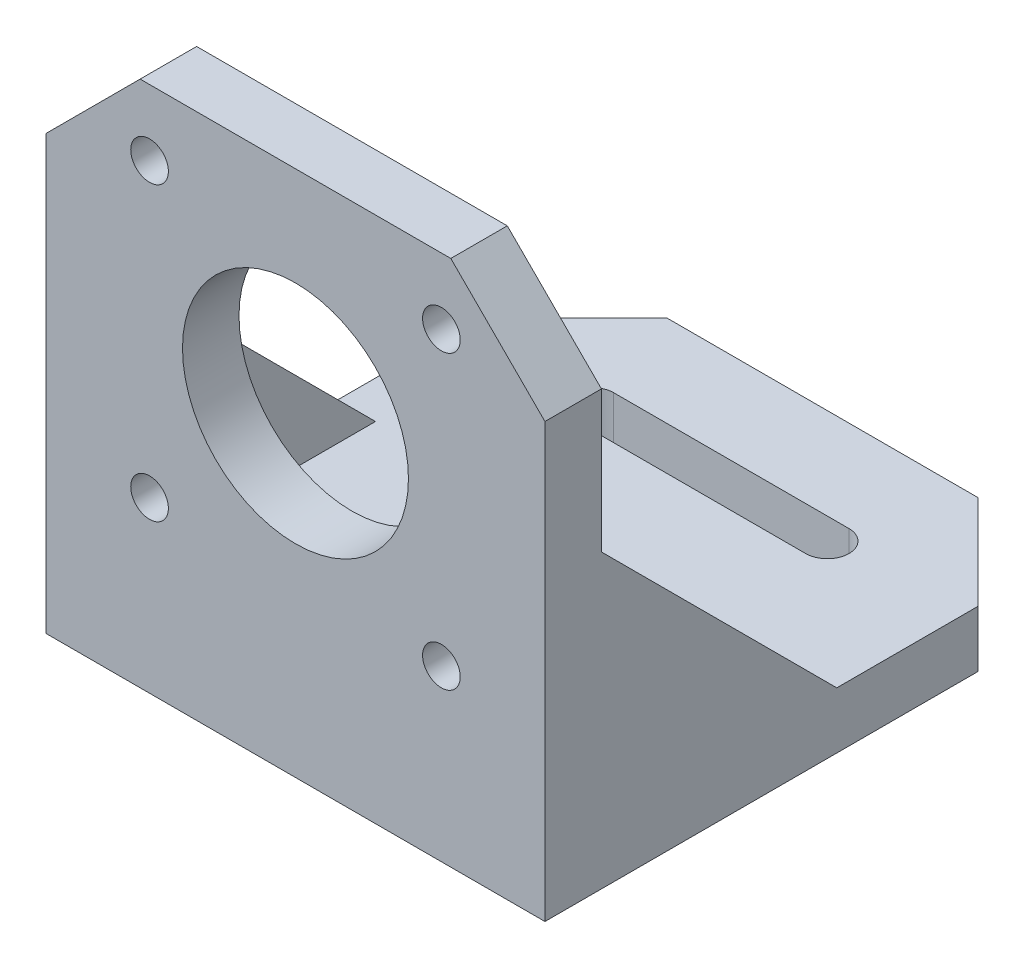
from build123d import *

# Parameters (mm, degrees)
EXTRUDE_1_DEPTH          = 53
EXTRUDE_2_DEPTH          = 4
EXTRUDE_3_DEPTH          = 4
CUT_EXTRUDE_1_DEPTH      = 96.294281046
CUT_EXTRUDE_1_DEPTH_BACK = 96.294281046
SKETCH_4_R               = 2
SKETCH_4_R_2             = 12
CHAMFER_1_SIZE           = 10
CUT_EXTRUDE_2_DEPTH      = 92.896681115
CHAMFER_2_SIZE           = 10
FILLET_1_R               = 3


with BuildPart() as part:
    # Эскиз1 → Бобышка-Вытянуть1 (new body)
    with BuildSketch(Plane(origin=(0, 0, 0), x_dir=(0, 0, -1), z_dir=(1, 0, 0))):
        Polygon((0, 0), (0, 56), (6, 56), (6, 6), (56, 6), (56, 0), align=None)
    extrude(amount=EXTRUDE_1_DEPTH)

    # Эскиз2 → Бобышка-Вытянуть2 (add)
    with BuildSketch(Plane(origin=(53, 0, 0), x_dir=(0, 0, -1), z_dir=(1, 0, 0))):
        Polygon((6, 31), (31, 6), (6, 6), align=None)
    extrude(amount=-EXTRUDE_2_DEPTH)

    # Эскиз4 → Вырез-Вытянуть1 (cut, two sides: drawn at the far end of the back side and taken through both)
    with BuildSketch(Plane.XY.offset(-CUT_EXTRUDE_1_DEPTH_BACK)):
        with Locations(Location((11, 49, 0), (0, 0, 270))):
            Circle(SKETCH_4_R)
        with Locations(Location((42, 49, 0), (0, 0, 270))):
            Circle(SKETCH_4_R)
        with Locations(Location((42, 18, 0), (0, 0, 270))):
            Circle(SKETCH_4_R)
        with Locations(Location((11, 18, 0), (0, 0, 270))):
            Circle(SKETCH_4_R)
        with Locations(Location((26.5, 33.5, 0), (0, 0, 270))):
            Circle(SKETCH_4_R_2)
    extrude(amount=CUT_EXTRUDE_1_DEPTH + CUT_EXTRUDE_1_DEPTH_BACK, mode=Mode.SUBTRACT)

    # Фаска1
    chamfer_1_edges = [part.edges().sort_by_distance(p)[0] for p in [
        (53, 56, -3),
        (0, 56, -3),
    ]]
    chamfer(chamfer_1_edges, length=CHAMFER_1_SIZE)

    # Эскиз5 → Вырез-Вытянуть2 (cut, through all)
    with BuildSketch(Plane(origin=(0, 6, 0), x_dir=(1, 0, 0), z_dir=(0, 1, 0))):
        with BuildLine():
            Line((44, 11.7), (9, 11.7))
            ThreePointArc((9, 11.7), (6.7, 14), (9, 16.3))
            Line((9, 16.3), (44, 16.3))
            ThreePointArc((44, 16.3), (46.3, 14), (44, 11.7))
        make_face()
        with BuildLine():
            Line((39, 41.7), (14, 41.7))
            ThreePointArc((14, 41.7), (11.7, 44), (14, 46.3))
            Line((14, 46.3), (39, 46.3))
            ThreePointArc((39, 46.3), (41.3, 44), (39, 41.7))
        make_face()
    extrude(amount=-CUT_EXTRUDE_2_DEPTH, mode=Mode.SUBTRACT)

    # Фаска2
    chamfer_2_edges = [part.edges().sort_by_distance(p)[0] for p in [
        (53, 3, -56),
        (0, 3, -56),
    ]]
    chamfer(chamfer_2_edges, length=CHAMFER_2_SIZE)

    # Скругление1
    fillet_1_edges = [part.edges().sort_by_distance(p)[0] for p in [
        (24.5, 6, -6),
    ]]
    fillet(fillet_1_edges, radius=FILLET_1_R)


with BuildPart() as body_2:
    # Эскиз3 → Бобышка-Вытянуть3 (new body)
    with BuildSketch(Plane.ZY):
        Polygon((-6, 31), (-6, 6), (-31, 6), align=None)
    extrude(amount=-EXTRUDE_3_DEPTH)


solid = Compound([part.part, body_2.part])
